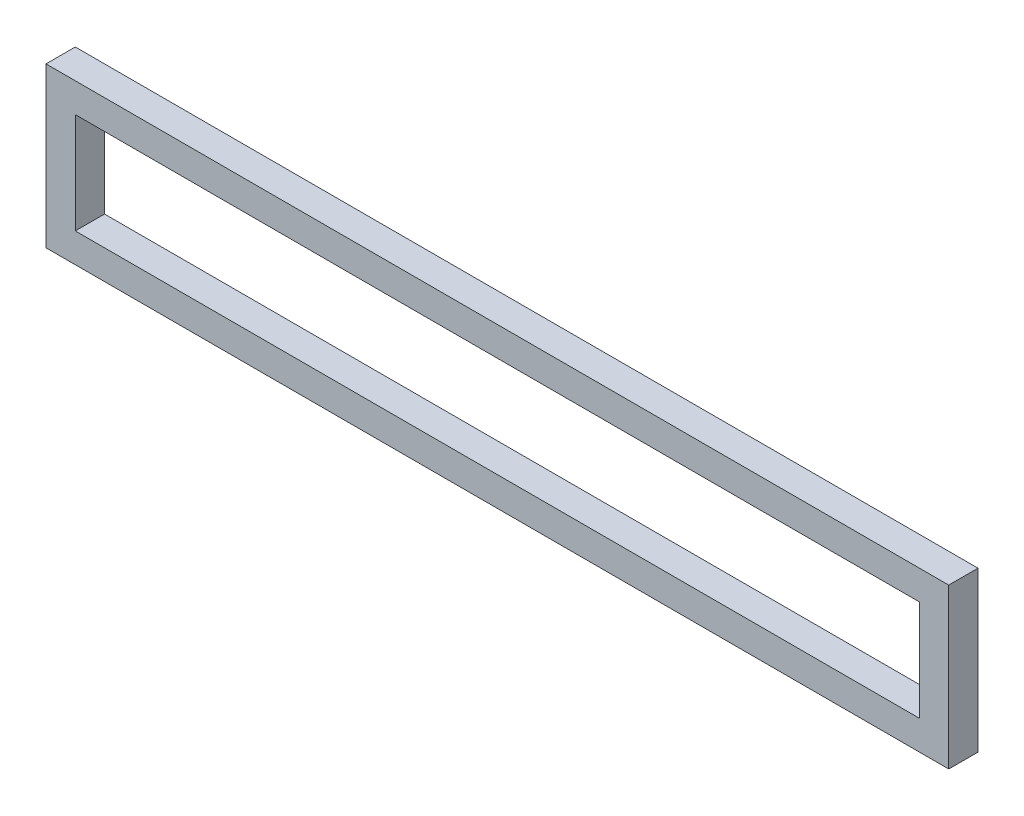
from build123d import *

# Parameters (mm, degrees)
SKETCH2_W           = 431.8
SKETCH2_H           = 76.2
BOSS_EXTRUDE3_DEPTH = 13.9999974
SKETCH3_W           = 403.8000052
SKETCH3_H           = 48.2000052
CUT_EXTRUDE1_DEPTH  = 13.9999974


with BuildPart() as part:
    # Sketch2 → Boss-Extrude3 (new body)
    with BuildSketch(Plane.XY):
        Rectangle(SKETCH2_W, SKETCH2_H)
    extrude(amount=BOSS_EXTRUDE3_DEPTH)

    # Sketch3 → Cut-Extrude1 (cut)
    with BuildSketch(Plane.XY.offset(13.9999974)):
        Rectangle(SKETCH3_W, SKETCH3_H)
    extrude(amount=-CUT_EXTRUDE1_DEPTH, mode=Mode.SUBTRACT)


solid = part.part
